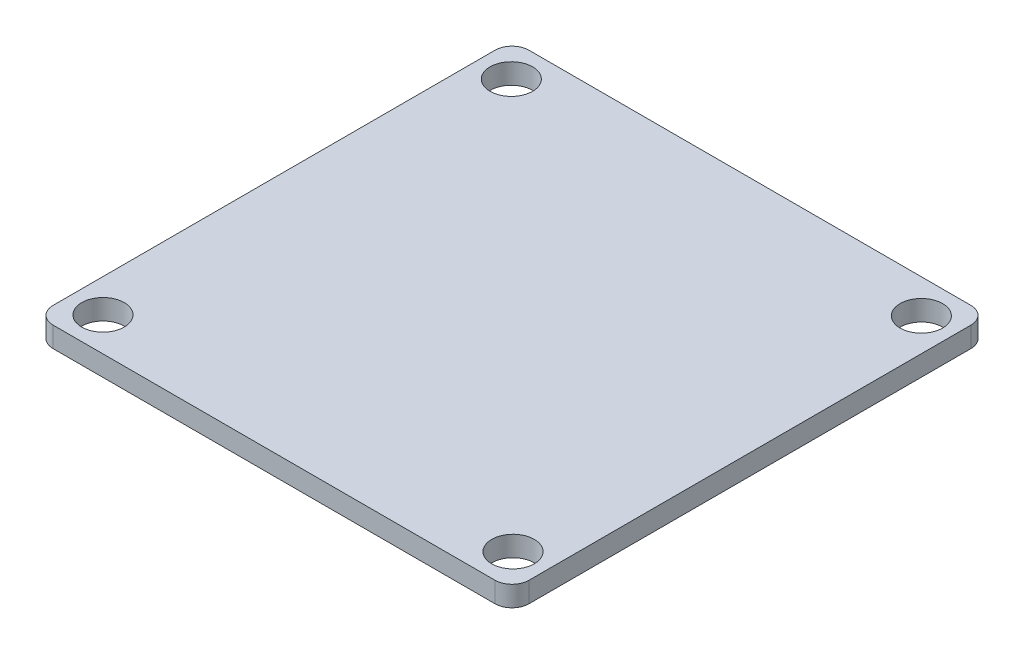
from build123d import *

# Parameters (mm, degrees)
SKETCH1_R           = 1.5875
BOSS_EXTRUDE2_DEPTH = 1.524


with BuildPart() as part:
    # Sketch1 → Boss-Extrude2 (new body)
    with BuildSketch(Plane(origin=(0, 0, 0), x_dir=(1, 0, 0), z_dir=(0, 1, 0))):
        with BuildLine():
            Line((-50.746188486, 35.427401309), (-17.726188486, 35.427401309))
            ThreePointArc((-17.726188486, 35.427401309), (-16.828162874, 35.055426921), (-16.456188486, 34.157401309))
            Line((-16.456188486, 34.157401309), (-16.456188486, 27.108901309))
            Line((-16.456188486, 27.108901309), (-16.456188486, 8.185901309))
            Line((-16.456188486, 8.185901309), (-16.456188486, 1.137401309))
            ThreePointArc((-16.456188486, 1.137401309), (-16.828162874, 0.239375697), (-17.726188486, -0.132598691))
            Line((-17.726188486, -0.132598691), (-50.746188486, -0.132598691))
            ThreePointArc((-50.746188486, -0.132598691), (-51.644214098, 0.239375697), (-52.016188486, 1.137401309))
            Line((-52.016188486, 1.137401309), (-52.016188486, 34.157401309))
            ThreePointArc((-52.016188486, 34.157401309), (-51.644214098, 35.055426921), (-50.746188486, 35.427401309))
        make_face()
        with Locations(Location((-49.539688486, 32.900101309, 0), (0, 0, 90))):
            Circle(SKETCH1_R, mode=Mode.SUBTRACT)
        with Locations(Location((-18.907288486, 32.900101309, 0), (0, 0, 90))):
            Circle(SKETCH1_R, mode=Mode.SUBTRACT)
        with Locations(Location((-18.907288486, 2.394701309, 0), (0, 0, 90))):
            Circle(SKETCH1_R, mode=Mode.SUBTRACT)
        with Locations(Location((-49.539688486, 2.394701309, 0), (0, 0, 90))):
            Circle(SKETCH1_R, mode=Mode.SUBTRACT)
    extrude(amount=BOSS_EXTRUDE2_DEPTH)


solid = part.part
